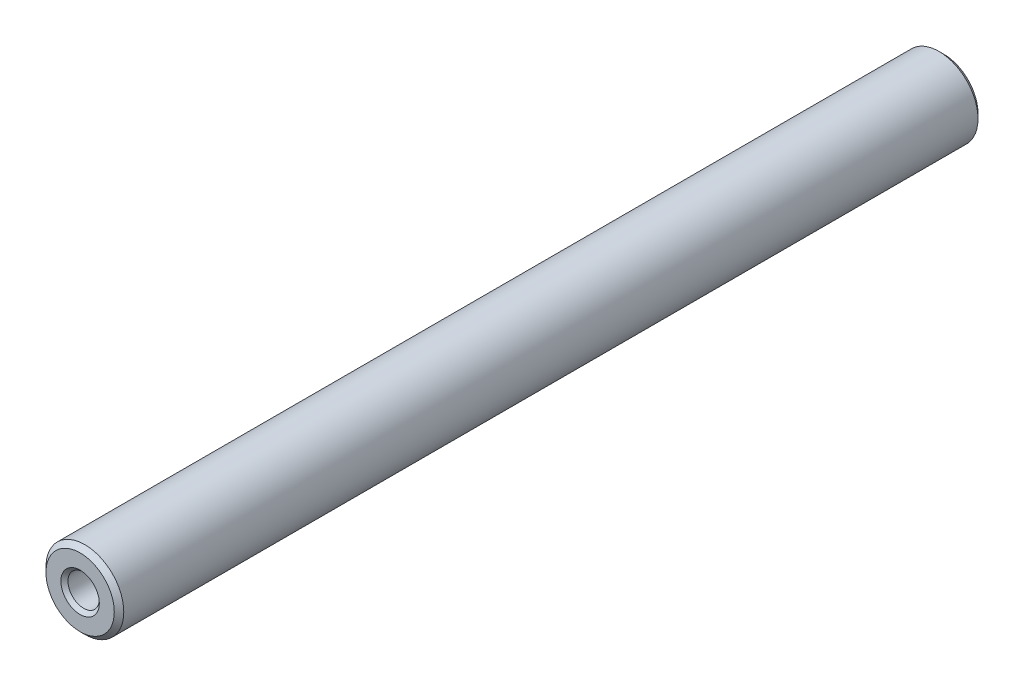
from build123d import *

# Parameters (mm, degrees)
SKETCH1_R                  = 4.1
BLANK_DEPTH                = 91
FURO_1_M4X11_5_D           = 3.3
FURO_1_M4X11_5_DEPTH       = 10.508579979
FURO_1_M4X11_5_CSINK_D     = 4.05
FURO_1_M4X11_5_CSINK_ANGLE = 90
FURO_1_M4X11_5_TIP         = 0.991420021
FURO_2_M4X11_5_D           = 3.3
FURO_2_M4X11_5_DEPTH       = 10.508579979
FURO_2_M4X11_5_CSINK_D     = 4.05
FURO_2_M4X11_5_CSINK_ANGLE = 90
FURO_2_M4X11_5_TIP         = 0.991420021
CHANFROS_SIZE              = 0.5


with BuildPart() as part:
    # Sketch1 → Blank (new body)
    with BuildSketch(Plane.XY):
        Circle(SKETCH1_R)
    extrude(amount=-BLANK_DEPTH)

    # Furo 1 -  M4x11.5
    with Locations(Plane.XY):
        with Locations((0, 0)):
            CounterSinkHole(FURO_1_M4X11_5_D / 2, FURO_1_M4X11_5_CSINK_D / 2, depth=FURO_1_M4X11_5_DEPTH, counter_sink_angle=FURO_1_M4X11_5_CSINK_ANGLE)
            with Locations((0, 0, -(FURO_1_M4X11_5_DEPTH + FURO_1_M4X11_5_TIP / 2))):  # 118° drill point
                Cone(0, FURO_1_M4X11_5_D / 2, FURO_1_M4X11_5_TIP, mode=Mode.SUBTRACT)

    # Furo 2 -  M4x11.5
    with Locations(Plane(origin=(0, 0, -91), x_dir=(-1, 0, 0), z_dir=(0, 0, -1))):
        with Locations((0, 0)):
            CounterSinkHole(FURO_2_M4X11_5_D / 2, FURO_2_M4X11_5_CSINK_D / 2, depth=FURO_2_M4X11_5_DEPTH, counter_sink_angle=FURO_2_M4X11_5_CSINK_ANGLE)
            with Locations((0, 0, -(FURO_2_M4X11_5_DEPTH + FURO_2_M4X11_5_TIP / 2))):  # 118° drill point
                Cone(0, FURO_2_M4X11_5_D / 2, FURO_2_M4X11_5_TIP, mode=Mode.SUBTRACT)

    # Chanfros
    chanfros_edges = [part.edges().sort_by_distance(p)[0] for p in [
        (-4.1, 0, 0),
        (-4.1, 0, -91),
    ]]
    chamfer(chanfros_edges, length=CHANFROS_SIZE)


solid = part.part
